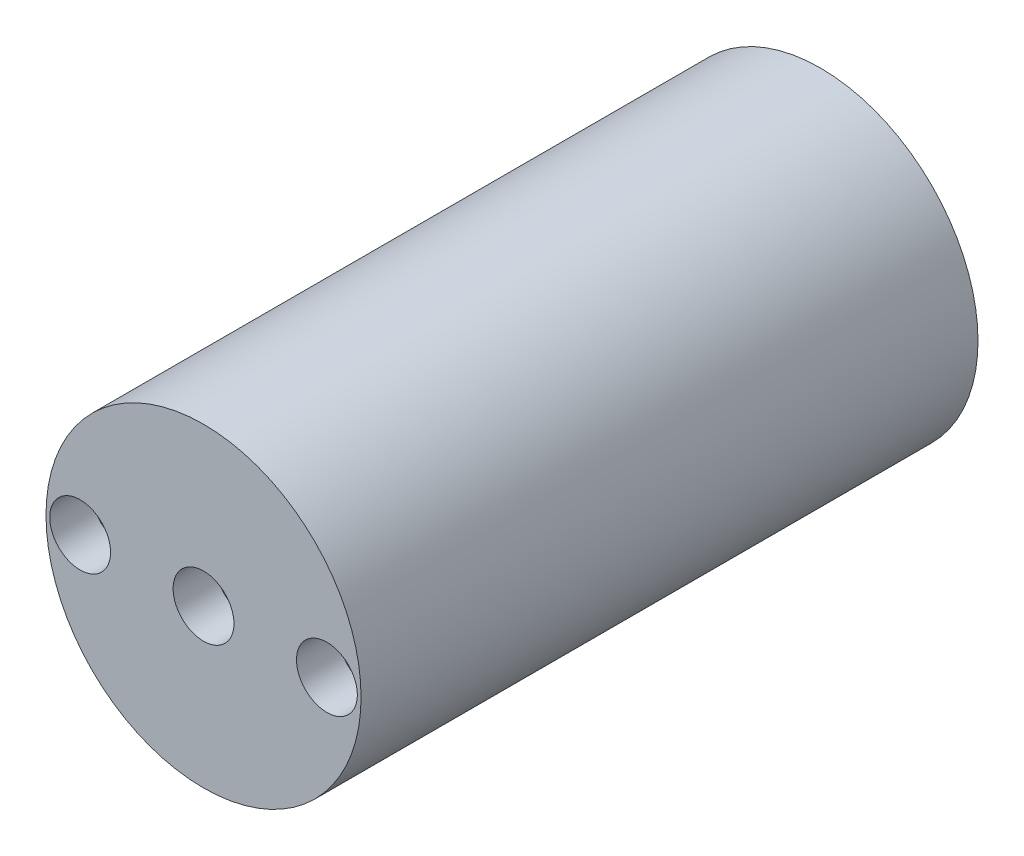
from build123d import *

# Parameters (mm, degrees)
SKETCH6_R           = 19.15
BOSS_EXTRUDE3_DEPTH = 75
SKETCH9_R           = 3.7
CUT_EXTRUDE2_DEPTH  = 5.15


with BuildPart() as part:
    # Sketch6 → Boss-Extrude3 (new body)
    with BuildSketch(Plane.XY):
        Circle(SKETCH6_R)
    extrude(amount=BOSS_EXTRUDE3_DEPTH)

    # Sketch9 → Cut-Extrude2 (cut)
    with BuildSketch(Plane.XY.offset(75)):
        Circle(SKETCH9_R)
        with Locations((-15, 0)):
            Circle(SKETCH9_R)
        with Locations((15, 0)):
            Circle(SKETCH9_R)
    extrude(amount=-CUT_EXTRUDE2_DEPTH, mode=Mode.SUBTRACT)


solid = part.part
